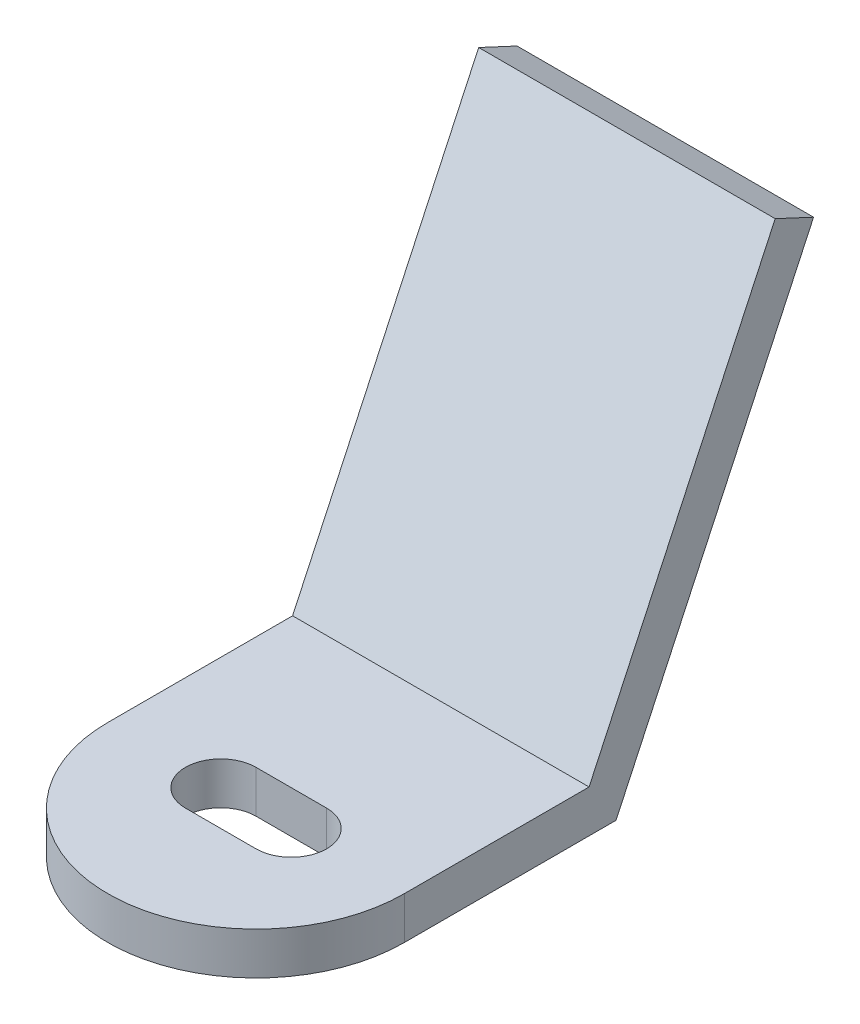
from build123d import *

# Parameters (mm, degrees)
BOSS_EXTRUDE1_DEPTH = 3
BOSS_EXTRUDE3_DEPTH = 21


with BuildPart() as part:
    # Sketch1 → Boss-Extrude1 (new body)
    with BuildSketch(Plane(origin=(0, 0, 0), x_dir=(1, 0, 0), z_dir=(0, 1, 0))):
        with BuildLine():
            Line((-10.5, 0), (-10.5, 15))
            Line((-10.5, 15), (10.5, 15))
            Line((10.5, 15), (10.5, 0))
            ThreePointArc((10.5, 0), (0, -10.5), (-10.5, 0))
        make_face()
        with BuildLine():
            Line((-2.5, 2.5), (2.5, 2.5))
            ThreePointArc((2.5, 2.5), (5, 0), (2.5, -2.5))
            Line((2.5, -2.5), (-2.5, -2.5))
            ThreePointArc((-2.5, -2.5), (-5, 0), (-2.5, 2.5))
        make_face(mode=Mode.SUBTRACT)
    extrude(amount=BOSS_EXTRUDE1_DEPTH)

    # Sketch3 → Boss-Extrude3 (add)
    with BuildSketch(Plane(origin=(10.5, 0, 0), x_dir=(0, 0, -1), z_dir=(1, 0, 0))):
        Polygon((15, 0), (28.989229745, 30), (26.270306384, 31.267854785), (11.689866243, 0), align=None)
    extrude(amount=-BOSS_EXTRUDE3_DEPTH)


solid = part.part
